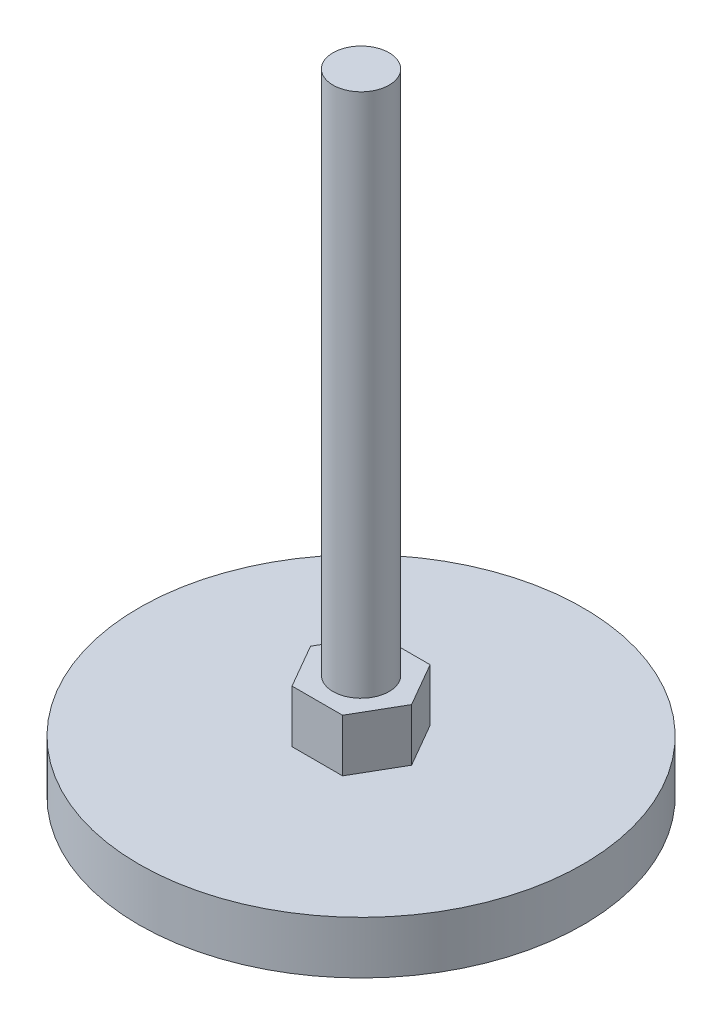
from build123d import *

# Parameters (mm, degrees)
CROQUIS1_R              = 50.744242673
SALIENTE_EXTRUIR1_DEPTH = 12
SALIENTE_EXTRUIR2_DEPTH = 12
CROQUIS3_R              = 6.412213352
SALIENTE_EXTRUIR3_DEPTH = 120


with BuildPart() as part:
    # Croquis1 → Saliente-Extruir1 (new body)
    with BuildSketch(Plane(origin=(0, 0, 0), x_dir=(1, 0, 0), z_dir=(0, 1, 0))):
        with Locations(Location((0, 0, 0), (0, 0, 270))):
            Circle(CROQUIS1_R)
    extrude(amount=SALIENTE_EXTRUIR1_DEPTH)

    # Croquis2 → Saliente-Extruir2 (add)
    with BuildSketch(Plane(origin=(0, 12, 0), x_dir=(1, 0, 0), z_dir=(0, 1, 0))):
        Polygon((11.547005384, 0), (5.773502692, 10), (-5.773502692, 10), (-11.547005384, 0), (-5.773502692, -10), (5.773502692, -10), align=None)
    extrude(amount=SALIENTE_EXTRUIR2_DEPTH)

    # Croquis3 → Saliente-Extruir3 (add)
    with BuildSketch(Plane(origin=(0, 24, 0), x_dir=(1, 0, 0), z_dir=(0, 1, 0))):
        with Locations(Location((0, 0, 0), (0, 0, 270))):
            Circle(CROQUIS3_R)
    extrude(amount=SALIENTE_EXTRUIR3_DEPTH)


solid = part.part
